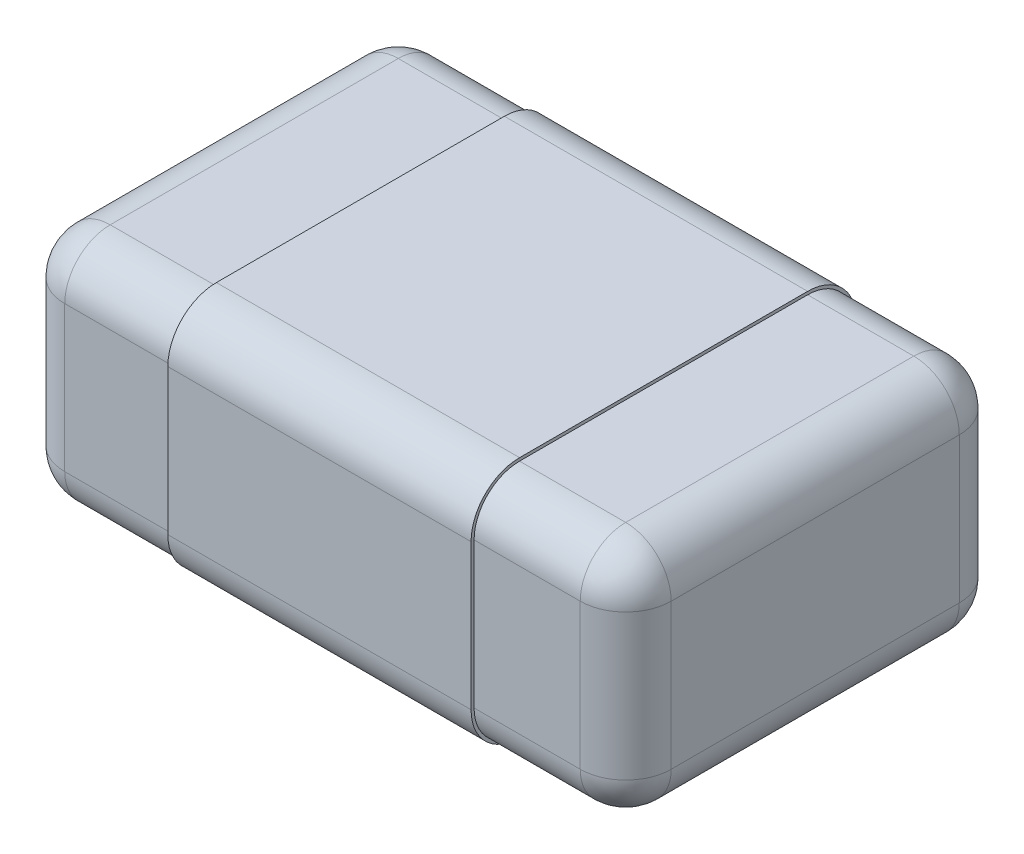
from build123d import *

# Parameters (mm, degrees)
ESBO_O1_W                     = 2
ESBO_O1_H                     = 1.25
RESSALTO_EXTRUS_O1_DEPTH      = 0.78
FILETE1_R                     = 0.15
RESSALTO_EXTRUS_O4_DEPTH      = 0.5
RESSALTO_EXTRUS_O4_DEPTH_BACK = 0.5
RESSALTO_EXTRUS_O5_DEPTH      = 0.02


with BuildPart() as part:
    # Esboço1 → Ressalto-extrusão1 (new body)
    with BuildSketch(Plane(origin=(0, 0, 0), x_dir=(1, 0, 0), z_dir=(0, 1, 0))):
        Rectangle(ESBO_O1_W, ESBO_O1_H)
    extrude(amount=-RESSALTO_EXTRUS_O1_DEPTH)

    # Filete1
    filete1_edges = [part.edges().sort_by_distance(p)[0] for p in [
        (1, -0.78, 0),
        (0, -0.78, -0.625),
        (-1, -0.78, 0),
        (0, 0, -0.625),
        (1, 0, 0),
        (0, 0, 0.625),
        (-1, 0, 0),
        (0, -0.78, 0.625),
        (-1, -0.39, -0.625),
        (1, -0.39, -0.625),
        (1, -0.39, 0.625),
        (-1, -0.39, 0.625),
    ]]
    fillet(filete1_edges, radius=FILETE1_R)

    # Esboço4 → Ressalto-extrusão4 (add, two sides: drawn at the far end of the back side and taken through both)
    with BuildSketch(Plane(origin=(0, 0, 0), x_dir=(0, 0, -1), z_dir=(1, 0, 0)).offset(-RESSALTO_EXTRUS_O4_DEPTH_BACK)):
        with BuildLine():
            Line((0.635, -0.63), (0.635, -0.15))
            ThreePointArc((0.635, -0.15), (0.588137085, -0.036862915), (0.475, 0.01))
            Line((0.475, 0.01), (-0.475, 0.01))
            ThreePointArc((-0.475, 0.01), (-0.588137085, -0.036862915), (-0.635, -0.15))
            Line((-0.635, -0.15), (-0.635, -0.63))
            ThreePointArc((-0.635, -0.63), (-0.588137085, -0.743137085), (-0.475, -0.79))
            Line((-0.475, -0.79), (0.475, -0.79))
            ThreePointArc((0.475, -0.79), (0.588137085, -0.743137085), (0.635, -0.63))
        make_face()
        with BuildLine():
            Line((0.625, -0.63), (0.625, -0.15))
            ThreePointArc((0.625, -0.15), (0.581066017, -0.043933983), (0.475, 0))
            Line((0.475, 0), (-0.475, 0))
            ThreePointArc((-0.475, 0), (-0.581066017, -0.043933983), (-0.625, -0.15))
            Line((-0.625, -0.15), (-0.625, -0.63))
            ThreePointArc((-0.625, -0.63), (-0.581066017, -0.736066017), (-0.475, -0.78))
            Line((-0.475, -0.78), (0.475, -0.78))
            ThreePointArc((0.475, -0.78), (0.581066017, -0.736066017), (0.625, -0.63))
        make_face(mode=Mode.SUBTRACT)
    extrude(amount=RESSALTO_EXTRUS_O4_DEPTH + RESSALTO_EXTRUS_O4_DEPTH_BACK)

    # Esboço2 → Ressalto-extrusão5 (add)
    # profile 1 of 3: a face of its own
    with BuildSketch(Plane(origin=(0, -0.79, 0), x_dir=(0, 0, 1), z_dir=(0, -1, 0))):
        with BuildLine():
            Line((0.240411447, -0.227848101), (0.240411447, -0.449367089))
            Line((0.240411447, -0.449367089), (0.151803852, -0.449367089))
            Line((0.151803852, -0.449367089), (0.151803852, -0.379746835))
            Line((0.151803852, -0.379746835), (-0.107689819, -0.379746835))
            Line((-0.107689819, -0.379746835), (-0.107689819, -0.449367089))
            Line((-0.107689819, -0.449367089), (-0.1899683, -0.449367089))
            add(Edge.make_bspline(
                [(-0.1899683, -0.449367089), (-0.19012994, -0.444249723), (-0.190452713, -0.434031056), (-0.192371039, -0.421451182), (-0.194625359, -0.411846862), (-0.196936571, -0.40541324), (-0.199537979, -0.399615701), (-0.201880811, -0.396296502), (-0.203022097, -0.394679589)],
                knots=[0, 0, 0, 0, 1.613816483, 3.222566973, 4.00434643, 4.721272461, 5.377081126, 6, 6, 6, 6], degree=3))
            add(Edge.make_bspline(
                [(-0.203022097, -0.394679589), (-0.204461211, -0.392957177), (-0.20735537, -0.389493284), (-0.212568341, -0.384991041), (-0.218600713, -0.381270226), (-0.225242397, -0.377986704), (-0.232653657, -0.375269127), (-0.24089787, -0.373371747), (-0.249954795, -0.371959143), (-0.256286804, -0.371552842), (-0.259588553, -0.371340981)],
                knots=[0, 0, 0, 0, 0.85147813, 1.712383349, 2.601498934, 3.536495334, 4.522642149, 5.591462363, 6.74409729, 8, 8, 8, 8], degree=3))
            Line((-0.259588553, -0.371340981), (-0.259588553, -0.297468354))
            Line((-0.259588553, -0.297468354), (0.151803852, -0.297468354))
            Line((0.151803852, -0.297468354), (0.151803852, -0.227848101))
            Line((0.151803852, -0.227848101), (0.240411447, -0.227848101))
        make_face()
    # profile 2 of 3: a face of its own
    with BuildSketch(Plane(origin=(0, -0.79, 0), x_dir=(0, 0, 1), z_dir=(0, -1, 0))):
        with BuildLine():
            add(Edge.make_bspline(
                [(-0.00988523, 0.120886076), (0.00066438, 0.120777596), (0.021112324, 0.120567332), (0.050770501, 0.119340622), (0.078415824, 0.117074446), (0.10401909, 0.113930641), (0.127675305, 0.11001546), (0.149219582, 0.104722524), (0.168857978, 0.09868919), (0.180855217, 0.093374077), (0.186613979, 0.090822785)],
                knots=[0, 0, 0, 0, 1.264448795, 2.450837183, 3.556883169, 4.58795224, 5.542121969, 6.428511603, 7.245674236, 8, 8, 8, 8], degree=3))
            add(Edge.make_bspline(
                [(0.186613979, 0.090822785), (0.191832724, 0.088116676), (0.201962475, 0.082864032), (0.215475974, 0.073081294), (0.227068062, 0.062211939), (0.236600164, 0.050031826), (0.243987269, 0.036453455), (0.249411672, 0.021580295), (0.252443019, 0.005204892), (0.252855826, -0.006145441), (0.253069675, -0.012025316)],
                knots=[0, 0, 0, 0, 1.083268664, 2.102659247, 3.066213605, 4.006517345, 4.942721993, 5.906487414, 6.915486013, 8, 8, 8, 8], degree=3))
            add(Edge.make_bspline(
                [(0.253069675, -0.012025316), (0.252852783, -0.017871645), (0.252432967, -0.029187831), (0.249431014, -0.045506204), (0.243963122, -0.060330616), (0.236600695, -0.073883764), (0.227031616, -0.0861274), (0.215297585, -0.09703571), (0.201515042, -0.106829225), (0.191236688, -0.112131567), (0.185921732, -0.114873418)],
                knots=[0, 0, 0, 0, 1.07440951, 2.079632991, 3.034098871, 3.966800755, 4.903586396, 5.876505587, 6.901937131, 8, 8, 8, 8], degree=3))
            add(Edge.make_bspline(
                [(0.185921732, -0.114873418), (0.180129026, -0.117422161), (0.168091236, -0.122718691), (0.148460723, -0.128771479), (0.127002925, -0.134018254), (0.103578021, -0.138143353), (0.078175642, -0.141083229), (0.050772622, -0.143405159), (0.021276728, -0.144615824), (0.000927931, -0.144827376), (-0.009588553, -0.144936709)],
                knots=[0, 0, 0, 0, 0.761707614, 1.582900397, 2.469804074, 3.421542703, 4.445391707, 5.54897881, 6.73328501, 8, 8, 8, 8], degree=3))
            add(Edge.make_bspline(
                [(-0.009588553, -0.144936709), (-0.020369762, -0.144887229), (-0.041117875, -0.144792007), (-0.071028581, -0.143333759), (-0.098482372, -0.1412524), (-0.123614463, -0.13823957), (-0.146683241, -0.134109276), (-0.167944168, -0.128750561), (-0.187668818, -0.122481979), (-0.199867758, -0.117027457), (-0.205791085, -0.114378956)],
                knots=[0, 0, 0, 0, 1.292793539, 2.487942473, 3.590368342, 4.594084519, 5.522245339, 6.398581889, 7.222414246, 8, 8, 8, 8], degree=3))
            add(Edge.make_bspline(
                [(-0.205791085, -0.114378956), (-0.211110301, -0.111609007), (-0.221376966, -0.106262704), (-0.235073612, -0.096336734), (-0.246722638, -0.085334478), (-0.256127396, -0.072993755), (-0.263517384, -0.059482581), (-0.268421711, -0.044656959), (-0.271798667, -0.028757919), (-0.272094432, -0.017714037), (-0.272246781, -0.012025316)],
                knots=[0, 0, 0, 0, 1.109275554, 2.141022398, 3.121040764, 4.065986229, 5.002793741, 5.958326063, 6.948330593, 8, 8, 8, 8], degree=3))
            add(Edge.make_bspline(
                [(-0.272246781, -0.012025316), (-0.272046579, -0.006043877), (-0.271660816, 0.005481624), (-0.268470632, 0.021993085), (-0.263150324, 0.036960304), (-0.255454148, 0.050345773), (-0.245642566, 0.062390805), (-0.233819981, 0.0732678), (-0.219846704, 0.08298967), (-0.209487785, 0.0882761), (-0.204109914, 0.09102057)],
                knots=[0, 0, 0, 0, 1.090787275, 2.10181366, 3.055147114, 3.976595958, 4.904774509, 5.879576888, 6.899174391, 8, 8, 8, 8], degree=3))
            add(Edge.make_bspline(
                [(-0.204109914, 0.09102057), (-0.198282864, 0.093565617), (-0.186203782, 0.098841329), (-0.166564535, 0.104939577), (-0.145056829, 0.110083568), (-0.121581167, 0.114013891), (-0.096247041, 0.117211018), (-0.069048851, 0.119254133), (-0.040063859, 0.120736953), (-0.020139192, 0.120835408), (-0.00988523, 0.120886076)],
                knots=[0, 0, 0, 0, 0.770502262, 1.59719915, 2.489107463, 3.450471223, 4.48167079, 5.584362407, 6.7568247, 8, 8, 8, 8], degree=3))
        make_face()
        with BuildLine():
            add(Edge.make_bspline(
                [(-0.00988523, 0.032278481), (-0.017335235, 0.032224744), (-0.03164288, 0.032121543), (-0.052217355, 0.031779129), (-0.07104871, 0.031022732), (-0.088152315, 0.029776962), (-0.103569772, 0.028501522), (-0.117255137, 0.026701021), (-0.129212067, 0.024681932), (-0.139562429, 0.02231793), (-0.148443418, 0.019579571), (-0.156053558, 0.016386943), (-0.162575373, 0.012891542), (-0.167915103, 0.008780082), (-0.172136864, 0.004265744), (-0.175104817, -0.00076613), (-0.176997981, -0.00622262), (-0.177204629, -0.010064822), (-0.177310072, -0.012025316)],
                knots=[0, 0, 0, 0, 1.929100326, 3.704814234, 5.327997663, 6.808188623, 8.145079156, 9.332956936, 10.381192375, 11.283900527, 12.080268448, 12.784124463, 13.418341996, 13.990284721, 14.521958489, 15.007958048, 15.493807677, 16, 16, 16, 16], degree=3))
            add(Edge.make_bspline(
                [(-0.177310072, -0.012025316), (-0.177201487, -0.013952383), (-0.176986902, -0.017760626), (-0.175104835, -0.023185486), (-0.172136995, -0.028217841), (-0.167914478, -0.032730347), (-0.162578032, -0.036849502), (-0.156030446, -0.040317584), (-0.148470728, -0.043661172), (-0.139557656, -0.046357536), (-0.129213554, -0.048735481), (-0.117222845, -0.050759578), (-0.103502855, -0.052543669), (-0.088020951, -0.053833617), (-0.0708179, -0.05507521), (-0.051854642, -0.055827566), (-0.031148424, -0.056172575), (-0.016774848, -0.05627552), (-0.009291876, -0.056329114)],
                knots=[0, 0, 0, 0, 0.496275509, 0.980733238, 1.465340469, 1.995491057, 2.565795237, 3.198195815, 3.903381773, 4.697468199, 5.597590203, 6.642822578, 7.835737307, 9.168797815, 10.653238981, 12.288779388, 14.067915585, 16, 16, 16, 16], degree=3))
            add(Edge.make_bspline(
                [(-0.009291876, -0.056329114), (-0.001973728, -0.056275178), (0.012136138, -0.056171186), (0.03247988, -0.05582839), (0.051179383, -0.055073158), (0.068184397, -0.053829711), (0.083534738, -0.052544366), (0.097188903, -0.050756791), (0.109205617, -0.048707271), (0.119659211, -0.04637592), (0.128722094, -0.043638718), (0.136452147, -0.040314019), (0.143172519, -0.036869708), (0.148638271, -0.03276527), (0.152840617, -0.028184778), (0.155947608, -0.023217447), (0.157803261, -0.017756603), (0.158022185, -0.013951031), (0.158132966, -0.012025316)],
                knots=[0, 0, 0, 0, 1.896767928, 3.657092201, 5.27328851, 6.746368892, 8.076025924, 9.26503724, 10.314272961, 11.23449221, 12.039773993, 12.763366423, 13.413189726, 13.992459479, 14.524640598, 15.015510453, 15.501823705, 16, 16, 16, 16], degree=3))
            add(Edge.make_bspline(
                [(0.158132966, -0.012025316), (0.15802208, -0.010099752), (0.15780295, -0.006294478), (0.155948822, -0.000831439), (0.152835849, 0.004127284), (0.148671843, 0.008728943), (0.143106752, 0.012682069), (0.136512584, 0.016318615), (0.128687955, 0.01944403), (0.119667636, 0.022250216), (0.109191238, 0.024514546), (0.097179523, 0.026795554), (0.083416992, 0.028298466), (0.068000477, 0.029876176), (0.050905713, 0.030829761), (0.032154994, 0.031837726), (0.011706673, 0.032104279), (-0.002501472, 0.032218909), (-0.00988523, 0.032278481)],
                knots=[0, 0, 0, 0, 0.496691071, 0.981554468, 1.470960882, 2.001555398, 2.573987342, 3.225948283, 3.944107278, 4.746988257, 5.664464036, 6.712061857, 7.904911462, 9.239876577, 10.716497891, 12.328258503, 14.091851269, 16, 16, 16, 16], degree=3))
        make_face(mode=Mode.SUBTRACT)
    # profile 3 of 3: a face of its own
    with BuildSketch(Plane(origin=(0, -0.79, 0), x_dir=(0, 0, 1), z_dir=(0, -1, 0))):
        with BuildLine():
            add(Edge.make_bspline(
                [(0.091083915, 0.450632911), (0.097053447, 0.450509358), (0.108785804, 0.450266531), (0.125962302, 0.448646824), (0.142305783, 0.445603054), (0.157799263, 0.44161447), (0.172377919, 0.436489934), (0.185869221, 0.430263312), (0.198287496, 0.422964234), (0.205694588, 0.417127981), (0.209359232, 0.414240506)],
                knots=[0, 0, 0, 0, 1.134951389, 2.230602796, 3.275446553, 4.29236384, 5.269554879, 6.208874539, 7.113844281, 8, 8, 8, 8], degree=3))
            add(Edge.make_bspline(
                [(0.209359232, 0.414240506), (0.2127705, 0.411189439), (0.219533431, 0.405140616), (0.228167833, 0.394717509), (0.23582354, 0.383703866), (0.242077724, 0.371707746), (0.247123043, 0.358665047), (0.25063184, 0.344347483), (0.252704345, 0.32872668), (0.25294503, 0.317892958), (0.253069675, 0.312282437)],
                knots=[0, 0, 0, 0, 0.955266016, 1.893840718, 2.820634586, 3.754367388, 4.713946363, 5.736548792, 6.827813699, 8, 8, 8, 8], degree=3))
            add(Edge.make_bspline(
                [(0.253069675, 0.312282437), (0.252962149, 0.305883194), (0.252754409, 0.293519747), (0.250987221, 0.275656885), (0.247970503, 0.259169723), (0.243671666, 0.244172636), (0.23869952, 0.230568383), (0.233326183, 0.218330164), (0.227914993, 0.207265708), (0.223722107, 0.20063384), (0.221720782, 0.197468354)],
                knots=[0, 0, 0, 0, 1.271933853, 2.45739788, 3.56403977, 4.599221435, 5.554937142, 6.441247417, 7.255985077, 8, 8, 8, 8], degree=3))
            Line((0.221720782, 0.197468354), (0.113829169, 0.197468354))
            Line((0.113829169, 0.197468354), (0.113829169, 0.205874209))
            add(Edge.make_bspline(
                [(0.113829169, 0.205874209), (0.116773443, 0.209066417), (0.122695825, 0.215487517), (0.130869901, 0.225919795), (0.138193223, 0.237268836), (0.145102081, 0.248979277), (0.150773289, 0.260947818), (0.154979882, 0.272618529), (0.157655172, 0.283812355), (0.157977308, 0.291139201), (0.158132966, 0.294679589)],
                knots=[0, 0, 0, 0, 1.028515649, 2.068850487, 3.134434502, 4.226024606, 5.287939915, 6.266010027, 7.162122652, 8, 8, 8, 8], degree=3))
            add(Edge.make_bspline(
                [(0.158132966, 0.294679589), (0.157967363, 0.298909235), (0.157619397, 0.307796623), (0.155525141, 0.318921878), (0.153055031, 0.328005688), (0.149838156, 0.334308479), (0.14592635, 0.340209222), (0.142479798, 0.343461546), (0.140727903, 0.345114715)],
                knots=[0, 0, 0, 0, 1.383822774, 2.907706505, 3.696267359, 4.453880301, 5.214101212, 6, 6, 6, 6], degree=3))
            add(Edge.make_bspline(
                [(0.140727903, 0.345114715), (0.137650114, 0.347558836), (0.131257704, 0.352635149), (0.121545824, 0.356910215), (0.112632122, 0.359733982), (0.104401993, 0.360968757), (0.094929568, 0.361895895), (0.088153276, 0.361980445), (0.084557017, 0.362025316)],
                knots=[0, 0, 0, 0, 1.17336722, 2.437023599, 3.149324183, 3.970868836, 4.92311568, 6, 6, 6, 6], degree=3))
            add(Edge.make_bspline(
                [(0.084557017, 0.362025316), (0.081027018, 0.361955452), (0.074372913, 0.361823756), (0.065002919, 0.360702671), (0.056936311, 0.358631198), (0.050052002, 0.355875338), (0.044329839, 0.352346183), (0.039527085, 0.348302991), (0.035324556, 0.343888435), (0.033332401, 0.34041422), (0.032341827, 0.338686709)],
                knots=[0, 0, 0, 0, 1.405388907, 2.649180623, 3.747479513, 4.712702894, 5.590628025, 6.410723464, 7.209751833, 8, 8, 8, 8], degree=3))
            add(Edge.make_bspline(
                [(0.032341827, 0.338686709), (0.03142998, 0.336863083), (0.029574546, 0.333152355), (0.027770405, 0.327028188), (0.026453486, 0.320442524), (0.025676926, 0.311242073), (0.025409984, 0.300187215), (0.0252816, 0.291515122), (0.025221574, 0.287460443)],
                knots=[0, 0, 0, 0, 0.701148582, 1.426703207, 2.190614458, 3.012117132, 4.603000887, 6, 6, 6, 6], degree=3))
            Line((0.025221574, 0.287460443), (0.025221574, 0.273417722))
            Line((0.025221574, 0.273417722), (-0.063386021, 0.273417722))
            Line((-0.063386021, 0.273417722), (-0.063386021, 0.286669304))
            add(Edge.make_bspline(
                [(-0.063386021, 0.286669304), (-0.063455272, 0.291589096), (-0.063587726, 0.300999093), (-0.065283585, 0.314379314), (-0.068038724, 0.326548177), (-0.072048081, 0.333352491), (-0.073967509, 0.336609968)],
                knots=[0, 0, 0, 0, 1.139338921, 2.179193021, 3.128312282, 4, 4, 4, 4], degree=3))
            add(Edge.make_bspline(
                [(-0.073967509, 0.336609968), (-0.075144604, 0.338067341), (-0.077528059, 0.341018318), (-0.081972659, 0.3447793), (-0.087045131, 0.348023411), (-0.092781122, 0.350879523), (-0.099410871, 0.353029019), (-0.107036227, 0.354586808), (-0.115707438, 0.355573854), (-0.121861529, 0.355654062), (-0.125094882, 0.355696203)],
                knots=[0, 0, 0, 0, 0.792054515, 1.603800977, 2.451955997, 3.338654888, 4.310024996, 5.394433015, 6.631037583, 8, 8, 8, 8], degree=3))
            add(Edge.make_bspline(
                [(-0.125094882, 0.355696203), (-0.127636319, 0.355646326), (-0.132472698, 0.355551411), (-0.139363003, 0.354651034), (-0.145554029, 0.353210268), (-0.152540212, 0.350499658), (-0.160016751, 0.346296122), (-0.164576318, 0.341597066), (-0.166728585, 0.339378956)],
                knots=[0, 0, 0, 0, 0.989765321, 1.883532761, 2.702857336, 3.459039476, 4.800582506, 6, 6, 6, 6], degree=3))
            add(Edge.make_bspline(
                [(-0.166728585, 0.339378956), (-0.168629059, 0.336520165), (-0.172496417, 0.330702685), (-0.175401011, 0.320710601), (-0.176946736, 0.311148559), (-0.177196151, 0.305002588), (-0.177310072, 0.302195411)],
                knots=[0, 0, 0, 0, 1.043133073, 2.122717367, 3.142549896, 4, 4, 4, 4], degree=3))
            add(Edge.make_bspline(
                [(-0.177310072, 0.302195411), (-0.17706029, 0.298020075), (-0.176549144, 0.28947581), (-0.172961809, 0.276812285), (-0.167689707, 0.264345965), (-0.163303624, 0.256308201), (-0.161091718, 0.252254747)],
                knots=[0, 0, 0, 0, 0.943448275, 1.930640289, 2.956419505, 4, 4, 4, 4], degree=3))
            add(Edge.make_bspline(
                [(-0.161091718, 0.252254747), (-0.159009143, 0.249014008), (-0.154592346, 0.242140936), (-0.147988434, 0.234195188), (-0.142547416, 0.227951297), (-0.138771149, 0.223901281), (-0.135817999, 0.220310799), (-0.133873197, 0.218259931), (-0.133006275, 0.217345728)],
                knots=[0, 0, 0, 0, 1.543909965, 3.274378284, 4.136373371, 4.866604337, 5.494772765, 6, 6, 6, 6], degree=3))
            Line((-0.133006275, 0.217345728), (-0.133006275, 0.210126582))
            Line((-0.133006275, 0.210126582), (-0.240601211, 0.210126582))
            add(Edge.make_bspline(
                [(-0.240601211, 0.210126582), (-0.242450585, 0.213303994), (-0.246369384, 0.220036887), (-0.251809205, 0.23114714), (-0.25692918, 0.243865818), (-0.262215608, 0.257716956), (-0.26656988, 0.27251795), (-0.269916096, 0.2877018), (-0.271795048, 0.303104175), (-0.272095885, 0.313431485), (-0.272246781, 0.318611551)],
                knots=[0, 0, 0, 0, 0.771891608, 1.635628057, 2.594636255, 3.650327867, 4.747660996, 5.83112928, 6.912118025, 8, 8, 8, 8], degree=3))
            add(Edge.make_bspline(
                [(-0.272246781, 0.318611551), (-0.272162928, 0.323527912), (-0.272000999, 0.333021924), (-0.270450242, 0.346734122), (-0.26817752, 0.359473677), (-0.264691988, 0.371234892), (-0.260176084, 0.382048398), (-0.254988939, 0.392133686), (-0.248714576, 0.401286718), (-0.243888001, 0.40677054), (-0.241491243, 0.409493671)],
                knots=[0, 0, 0, 0, 1.199045861, 2.315484163, 3.362897413, 4.352810628, 5.301242744, 6.218611169, 7.11540602, 8, 8, 8, 8], degree=3))
            add(Edge.make_bspline(
                [(-0.241491243, 0.409493671), (-0.238696899, 0.412313667), (-0.233108984, 0.417952879), (-0.22327782, 0.424990816), (-0.212499908, 0.43108311), (-0.200543554, 0.435818114), (-0.187767102, 0.439761209), (-0.174090153, 0.442290823), (-0.15968961, 0.444099424), (-0.149824126, 0.444234605), (-0.144774471, 0.444303797)],
                knots=[0, 0, 0, 0, 0.899477092, 1.798705297, 2.733090891, 3.702715351, 4.710848355, 5.762743087, 6.854858352, 8, 8, 8, 8], degree=3))
            add(Edge.make_bspline(
                [(-0.144774471, 0.444303797), (-0.13774026, 0.44410545), (-0.124053298, 0.443719512), (-0.104205466, 0.440419218), (-0.085723176, 0.434865413), (-0.071472445, 0.428381022), (-0.060961816, 0.422356634), (-0.053920927, 0.417330456), (-0.047479686, 0.412149259), (-0.041765251, 0.406592552), (-0.036904716, 0.400565547), (-0.032634834, 0.394283254), (-0.029107381, 0.387581547), (-0.027371347, 0.382880184), (-0.026499154, 0.380518196)],
                knots=[0, 0, 0, 0, 1.770401226, 3.444794915, 5.049233062, 6.61689752, 7.37571781, 8.096540093, 8.792709469, 9.455985318, 10.099006896, 10.739021174, 11.366478004, 12, 12, 12, 12], degree=3))
            Line((-0.026499154, 0.380518196), (-0.021752319, 0.380518196))
            add(Edge.make_bspline(
                [(-0.021752319, 0.380518196), (-0.020681286, 0.384576743), (-0.018514064, 0.392789164), (-0.013959303, 0.402638269), (-0.008981778, 0.410192744), (-0.004345557, 0.415989843), (0.001501742, 0.421512344), (0.005845282, 0.424986086), (0.008113188, 0.426799842)],
                knots=[0, 0, 0, 0, 1.338731653, 2.708907517, 3.438678351, 4.224363953, 5.072881742, 6, 6, 6, 6], degree=3))
            add(Edge.make_bspline(
                [(0.008113188, 0.426799842), (0.010417283, 0.428504318), (0.015179942, 0.432027539), (0.023289496, 0.436373299), (0.032211654, 0.440482325), (0.042109731, 0.443996484), (0.052959889, 0.447020881), (0.064808968, 0.449142306), (0.077637915, 0.450450203), (0.086498549, 0.450570604), (0.091083915, 0.450632911)],
                knots=[0, 0, 0, 0, 0.781940693, 1.616303212, 2.506838174, 3.463859656, 4.481845554, 5.580393902, 6.747857106, 8, 8, 8, 8], degree=3))
        make_face()
    extrude(amount=RESSALTO_EXTRUS_O5_DEPTH)


solid = part.part
